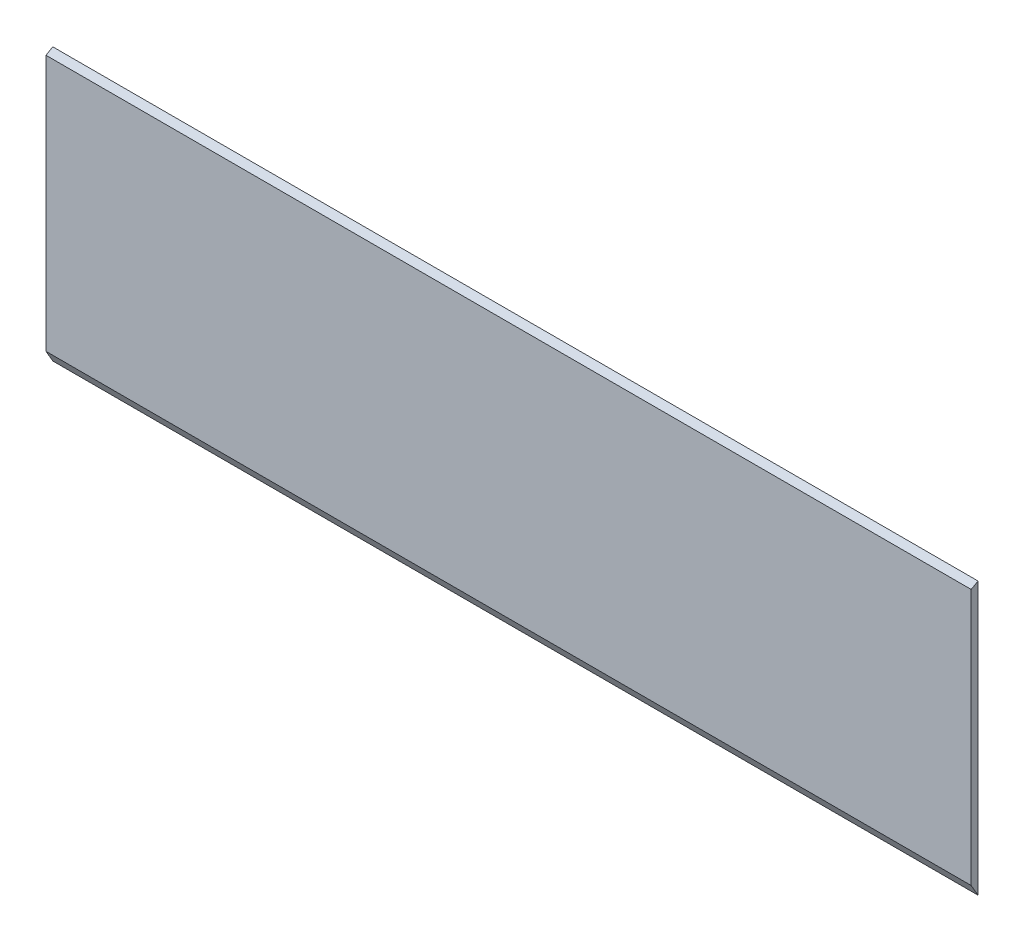
from build123d import *

# Parameters (mm, degrees)
SKETCH2_W               = 431.8
SKETCH2_H               = 127
BOSS_EXTRUDE1_DEPTH     = 3.175
CUT_EXTRUDE1_DEPTH      = 451.100345062
CUT_EXTRUDE1_DEPTH_BACK = 451.100345062
CUT_EXTRUDE2_DEPTH      = 451.100345062
CUT_EXTRUDE2_DEPTH_BACK = 451.100345062


with BuildPart() as part:
    # Sketch2 → Boss-Extrude1 (new body)
    with BuildSketch(Plane.XY):
        with Locations((215.9, 63.5)):
            Rectangle(SKETCH2_W, SKETCH2_H)
    extrude(amount=BOSS_EXTRUDE1_DEPTH)

    # Sketch3 → Cut-Extrude1 (cut, two sides: drawn at the far end of the back side and taken through both)
    with BuildSketch(Plane.ZY.offset(-CUT_EXTRUDE1_DEPTH_BACK)):
        Polygon((-132.039681301, -228.699436628), (0, 0), (3.175, 5.499261314), (135.214681301, 234.198697942), (592.613554557, -29.880664659), (325.359191955, -492.77879923), align=None)
    extrude(amount=CUT_EXTRUDE1_DEPTH + CUT_EXTRUDE1_DEPTH_BACK, mode=Mode.SUBTRACT)

    # Sketch4 → Cut-Extrude2 (cut, two sides: drawn at the far end of the back side and taken through both)
    with BuildSketch(Plane(origin=(431.8, 0, 0), x_dir=(0, 0, -1), z_dir=(1, 0, 0)).offset(-CUT_EXTRUDE2_DEPTH_BACK)):
        Polygon((228.699436628, 259.039681301), (0, 127), (-3.175, 125.166912895), (-231.874436628, -6.872768405), (-495.95379923, 450.526104851), (-35.379925973, 716.438554557), align=None)
    extrude(amount=CUT_EXTRUDE2_DEPTH + CUT_EXTRUDE2_DEPTH_BACK, mode=Mode.SUBTRACT)


solid = part.part
